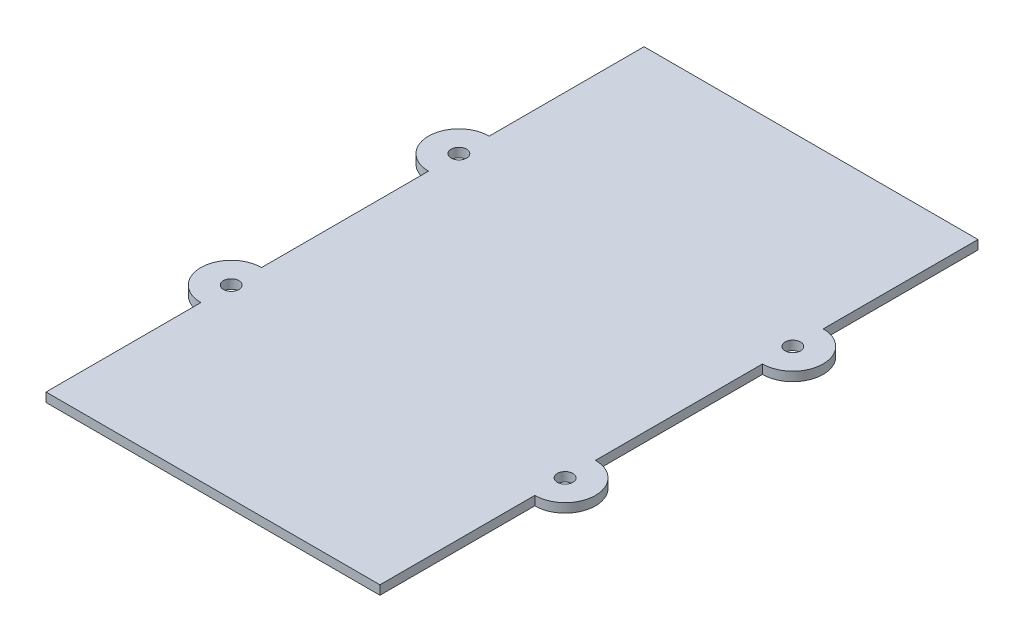
from build123d import *

# Parameters (mm, degrees)
SKETCH1_R           = 2.55
BOSS_EXTRUDE1_DEPTH = 3


with BuildPart() as part:
    # Sketch1 → Boss-Extrude1 (new body)
    with BuildSketch(Plane(origin=(0, 0, 0), x_dir=(1, 0, 0), z_dir=(0, 1, 0))):
        with BuildLine():
            Line((-55, 27.5), (-55, -27.5))
            ThreePointArc((-55, -27.5), (-65, -37.5), (-55, -47.5))
            Line((-55, -47.5), (-55, -98.5))
            Line((-55, -98.5), (55, -98.5))
            Line((55, -98.5), (55, -47.5))
            ThreePointArc((55, -47.5), (65, -37.5), (55, -27.5))
            Line((55, -27.5), (55, 27.5))
            ThreePointArc((55, 27.5), (65, 37.5), (55, 47.5))
            Line((55, 47.5), (55, 98.5))
            Line((55, 98.5), (-55, 98.5))
            Line((-55, 98.5), (-55, 47.5))
            ThreePointArc((-55, 47.5), (-65, 37.5), (-55, 27.5))
        make_face()
        with Locations(Location((-55, 37.5, 0), (0, 0, 270))):
            Circle(SKETCH1_R, mode=Mode.SUBTRACT)
        with Locations(Location((55, 37.5, 0), (0, 0, 270))):
            Circle(SKETCH1_R, mode=Mode.SUBTRACT)
        with Locations(Location((-55, -37.5, 0), (0, 0, 270))):
            Circle(SKETCH1_R, mode=Mode.SUBTRACT)
        with Locations(Location((55, -37.5, 0), (0, 0, 270))):
            Circle(SKETCH1_R, mode=Mode.SUBTRACT)
    extrude(amount=BOSS_EXTRUDE1_DEPTH)


solid = part.part
